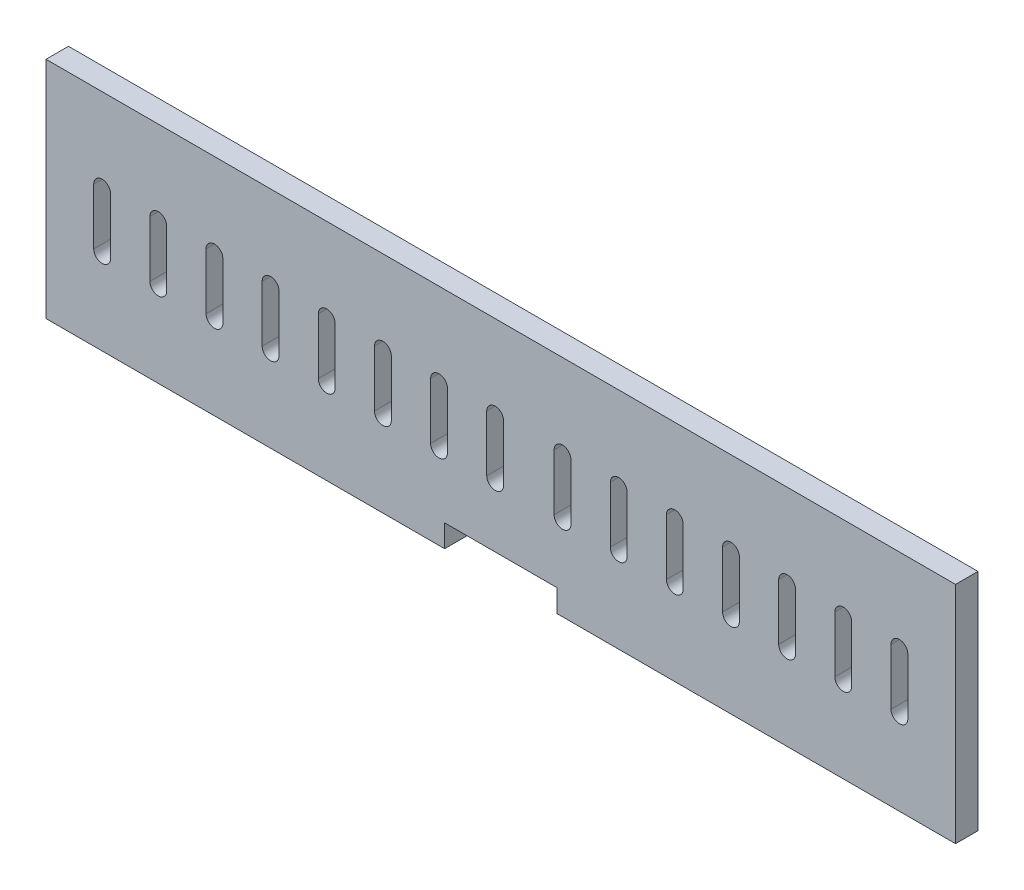
from build123d import *

# Parameters (mm, degrees)
BOSS_EXTRUDE1_DEPTH = 4


with BuildPart() as part:
    # Sketch1 → Boss-Extrude1 (new body)
    with BuildSketch(Plane.XY):
        Polygon((162, 0), (0, 0), (0, -40), (71, -40), (71, -36), (91, -36), (91, -40), (162, -40), align=None)
        with BuildLine():
            ThreePointArc((8.5, -15), (10, -13.5), (11.5, -15))
            Line((11.5, -15), (11.5, -25))
            ThreePointArc((11.5, -25), (10, -26.5), (8.5, -25))
            Line((8.5, -25), (8.5, -15))
        make_face(mode=Mode.SUBTRACT)
        with BuildLine():
            Line((18.5, -25), (18.5, -15))
            ThreePointArc((18.5, -15), (20, -13.5), (21.5, -15))
            Line((21.5, -15), (21.5, -25))
            ThreePointArc((21.5, -25), (20, -26.5), (18.5, -25))
        make_face(mode=Mode.SUBTRACT)
        with BuildLine():
            ThreePointArc((28.5, -15), (30, -13.5), (31.5, -15))
            Line((31.5, -15), (31.5, -25))
            ThreePointArc((31.5, -25), (30, -26.5), (28.5, -25))
            Line((28.5, -25), (28.5, -15))
        make_face(mode=Mode.SUBTRACT)
        with BuildLine():
            Line((38.5, -25), (38.5, -15))
            ThreePointArc((38.5, -15), (40, -13.5), (41.5, -15))
            Line((41.5, -15), (41.5, -25))
            ThreePointArc((41.5, -25), (40, -26.5), (38.5, -25))
        make_face(mode=Mode.SUBTRACT)
        with BuildLine():
            ThreePointArc((68.5, -15), (70, -13.5), (71.5, -15))
            Line((71.5, -15), (71.5, -25))
            ThreePointArc((71.5, -25), (70, -26.5), (68.5, -25))
            Line((68.5, -25), (68.5, -15))
        make_face(mode=Mode.SUBTRACT)
        with BuildLine():
            Line((78.5, -25), (78.5, -15))
            ThreePointArc((78.5, -15), (80, -13.5), (81.5, -15))
            Line((81.5, -15), (81.5, -25))
            ThreePointArc((81.5, -25), (80, -26.5), (78.5, -25))
        make_face(mode=Mode.SUBTRACT)
        with BuildLine():
            Line((90.5, -25), (90.5, -15))
            ThreePointArc((90.5, -15), (92, -13.5), (93.5, -15))
            Line((93.5, -15), (93.5, -25))
            ThreePointArc((93.5, -25), (92, -26.5), (90.5, -25))
        make_face(mode=Mode.SUBTRACT)
        with BuildLine():
            ThreePointArc((100.5, -15), (102, -13.5), (103.5, -15))
            Line((103.5, -15), (103.5, -25))
            ThreePointArc((103.5, -25), (102, -26.5), (100.5, -25))
            Line((100.5, -25), (100.5, -15))
        make_face(mode=Mode.SUBTRACT)
        with BuildLine():
            ThreePointArc((120.5, -15), (122, -13.5), (123.5, -15))
            Line((123.5, -15), (123.5, -25))
            ThreePointArc((123.5, -25), (122, -26.5), (120.5, -25))
            Line((120.5, -25), (120.5, -15))
        make_face(mode=Mode.SUBTRACT)
        with BuildLine():
            Line((130.5, -25), (130.5, -15))
            ThreePointArc((130.5, -15), (132, -13.5), (133.5, -15))
            Line((133.5, -15), (133.5, -25))
            ThreePointArc((133.5, -25), (132, -26.5), (130.5, -25))
        make_face(mode=Mode.SUBTRACT)
        with BuildLine():
            ThreePointArc((140.5, -15), (142, -13.5), (143.5, -15))
            Line((143.5, -15), (143.5, -25))
            ThreePointArc((143.5, -25), (142, -26.5), (140.5, -25))
            Line((140.5, -25), (140.5, -15))
        make_face(mode=Mode.SUBTRACT)
        with BuildLine():
            Line((150.5, -25), (150.5, -15))
            ThreePointArc((150.5, -15), (152, -13.5), (153.5, -15))
            Line((153.5, -15), (153.5, -25))
            ThreePointArc((153.5, -25), (152, -26.5), (150.5, -25))
        make_face(mode=Mode.SUBTRACT)
        with BuildLine():
            ThreePointArc((48.5, -15), (50, -13.5), (51.5, -15))
            Line((51.5, -15), (51.5, -25))
            ThreePointArc((51.5, -25), (50, -26.5), (48.5, -25))
            Line((48.5, -25), (48.5, -15))
        make_face(mode=Mode.SUBTRACT)
        with BuildLine():
            Line((58.5, -25), (58.5, -15))
            ThreePointArc((58.5, -15), (60, -13.5), (61.5, -15))
            Line((61.5, -15), (61.5, -25))
            ThreePointArc((61.5, -25), (60, -26.5), (58.5, -25))
        make_face(mode=Mode.SUBTRACT)
        with BuildLine():
            Line((110.5, -25), (110.5, -15))
            ThreePointArc((110.5, -15), (112, -13.5), (113.5, -15))
            Line((113.5, -15), (113.5, -25))
            ThreePointArc((113.5, -25), (112, -26.5), (110.5, -25))
        make_face(mode=Mode.SUBTRACT)
    extrude(amount=BOSS_EXTRUDE1_DEPTH)


solid = part.part
